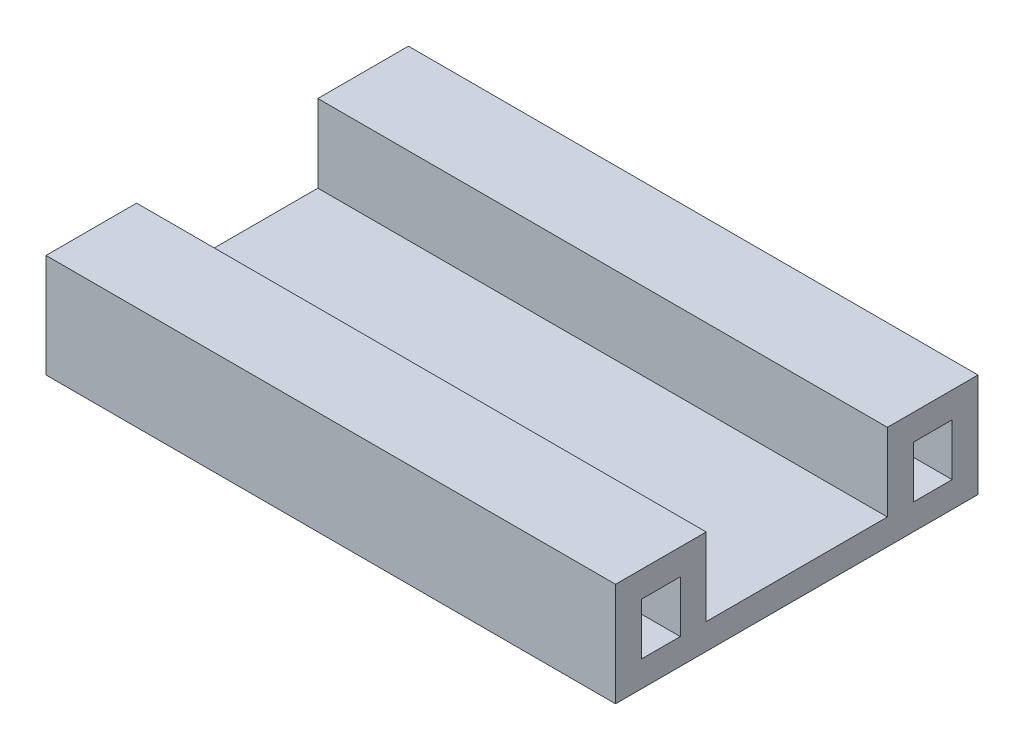
from build123d import *

# Parameters (mm, degrees)
SKETCH1_W           = 220
SKETCH1_H           = 140
BOSS_EXTRUDE1_DEPTH = 10
SKETCH2_W           = 220
SKETCH2_H           = 10
BOSS_EXTRUDE2_DEPTH = 30
SKETCH3_W           = 220
SKETCH3_H           = 10
BOSS_EXTRUDE3_DEPTH = 25
SKETCH4_W           = 220
SKETCH4_H           = 10
BOSS_EXTRUDE4_DEPTH = 20


with BuildPart() as part:
    # Sketch1 → Boss-Extrude1 (new body)
    with BuildSketch(Plane(origin=(0, 0, 0), x_dir=(1, 0, 0), z_dir=(0, 1, 0))):
        Rectangle(SKETCH1_W, SKETCH1_H)
    extrude(amount=BOSS_EXTRUDE1_DEPTH)

    # Sketch2 → Boss-Extrude2 (add)
    with BuildSketch(Plane(origin=(0, 10, 0), x_dir=(1, 0, 0), z_dir=(0, 1, 0))):
        with Locations((0, 65)):
            Rectangle(SKETCH2_W, SKETCH2_H)
        with Locations((0, -65)):
            Rectangle(SKETCH2_W, SKETCH2_H)
    extrude(amount=BOSS_EXTRUDE2_DEPTH)

    # Sketch3 → Boss-Extrude3 (add)
    with BuildSketch(Plane.XY.offset(-60)):
        with Locations((0, 35)):
            Rectangle(SKETCH3_W, SKETCH3_H)
    boss_extrude3 = extrude(amount=BOSS_EXTRUDE3_DEPTH)

    # Mirror1: Boss-Extrude3 across plane
    add(boss_extrude3.mirror(Plane.XY))

    # Sketch4 → Boss-Extrude4 (add)
    with BuildSketch(Plane.XZ.offset(-30)):
        with Locations((0, -40)):
            Rectangle(SKETCH4_W, SKETCH4_H)
    boss_extrude4 = extrude(amount=BOSS_EXTRUDE4_DEPTH)

    # Mirror2: Boss-Extrude4 across plane
    add(boss_extrude4.mirror(Plane.XY))


solid = part.part
